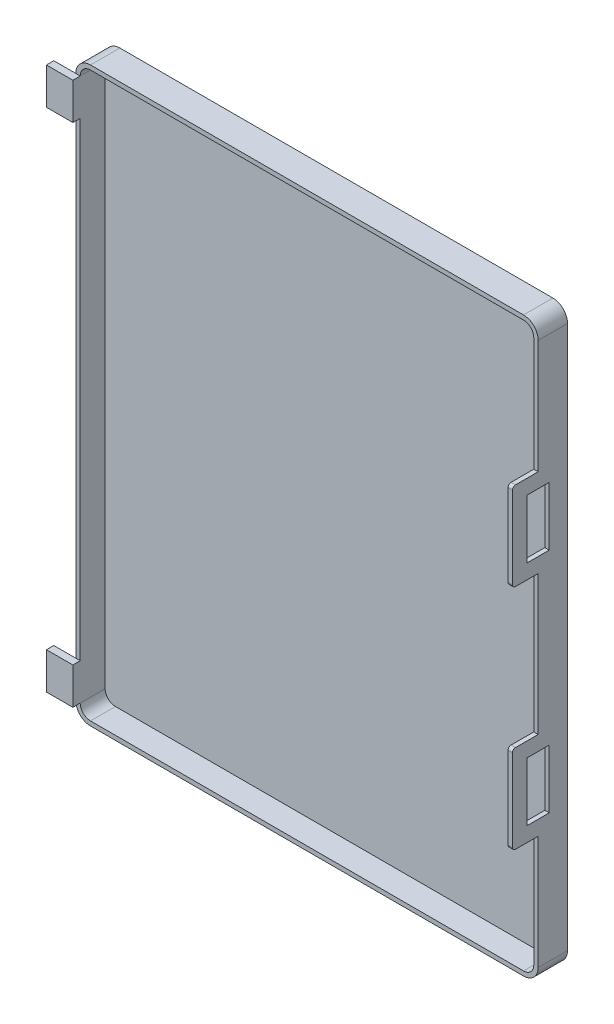
from build123d import *

# Parameters (mm, degrees)
BOSS_EXTRUDE1_DEPTH = 2
SHELL1_T            = -0.3
BOSS_EXTRUDE2_DEPTH = 0.3
SKETCH3_W           = 0.75
SKETCH3_H           = 4
CUT_EXTRUDE1_DEPTH  = 0.3
FILLET1_R           = 0.2
BOSS_EXTRUDE4_DEPTH = 0.5


with BuildPart() as part:
    # Sketch1 → Boss-Extrude1 (new body)
    with BuildSketch(Plane.XY):
        with BuildLine():
            Line((-14.75, 19.5), (14.75, 19.5))
            ThreePointArc((14.75, 19.5), (15.457106781, 19.207106781), (15.75, 18.5))
            Line((15.75, 18.5), (15.75, -18.5))
            ThreePointArc((15.75, -18.5), (15.457106781, -19.207106781), (14.75, -19.5))
            Line((14.75, -19.5), (-14.75, -19.5))
            ThreePointArc((-14.75, -19.5), (-15.457106781, -19.207106781), (-15.75, -18.5))
            Line((-15.75, -18.5), (-15.75, 18.5))
            ThreePointArc((-15.75, 18.5), (-15.457106781, 19.207106781), (-14.75, 19.5))
        make_face()
    extrude(amount=BOSS_EXTRUDE1_DEPTH)

    # Shell1
    shell1_openings = [part.faces().sort_by_distance(p)[0] for p in [
        (0, 0, 2),
    ]]
    offset(amount=SHELL1_T, openings=shell1_openings, kind=Kind.INTERSECTION)

    # Sketch2 → Boss-Extrude2 (add)
    with BuildSketch(Plane(origin=(15.75, 0, 0), x_dir=(0, 0, -1), z_dir=(1, 0, 0))):
        Polygon((-2, 10.75), (-3.75, 10.75), (-3.75, 4.75), (-2, 4.75), (-2, 5.75), (-2.75, 5.75), (-2.75, 9.75), (-2, 9.75), align=None)
    boss_extrude2 = extrude(amount=-BOSS_EXTRUDE2_DEPTH)

    # Mirror1: Boss-Extrude2 across plane
    add(boss_extrude2.mirror(Plane.ZX))

    # Sketch3 → Cut-Extrude1 (cut)
    with BuildSketch(Plane(origin=(15.75, 0, 0), x_dir=(0, 0, -1), z_dir=(1, 0, 0))):
        with Locations((-1.625, 7.75)):
            Rectangle(SKETCH3_W, SKETCH3_H)
        with Locations((-1.625, -7.75)):
            Rectangle(SKETCH3_W, SKETCH3_H)
    extrude(amount=-CUT_EXTRUDE1_DEPTH, mode=Mode.SUBTRACT)

    # Fillet1
    fillet1_edges = [part.edges().sort_by_distance(p)[0] for p in [
        (15.6, -10.75, 3.75),
        (15.6, 4.75, 3.75),
        (15.6, 10.75, 3.75),
        (15.6, -4.75, 3.75),
    ]]
    fillet(fillet1_edges, radius=FILLET1_R)

    # Sketch6 → Boss-Extrude4 (add)
    with BuildSketch(Plane.XY.offset(2)):
        Polygon((-17.25, -18.5), (-15.75, -18.5), (-15.45, -18.5), (-15.45, -16), (-15.75, -16), (-17.25, -16), align=None)
        Polygon((-17.25, 16), (-15.75, 16), (-15.45, 16), (-15.45, 18.5), (-15.75, 18.5), (-17.25, 18.5), align=None)
    extrude(amount=BOSS_EXTRUDE4_DEPTH)


solid = part.part
